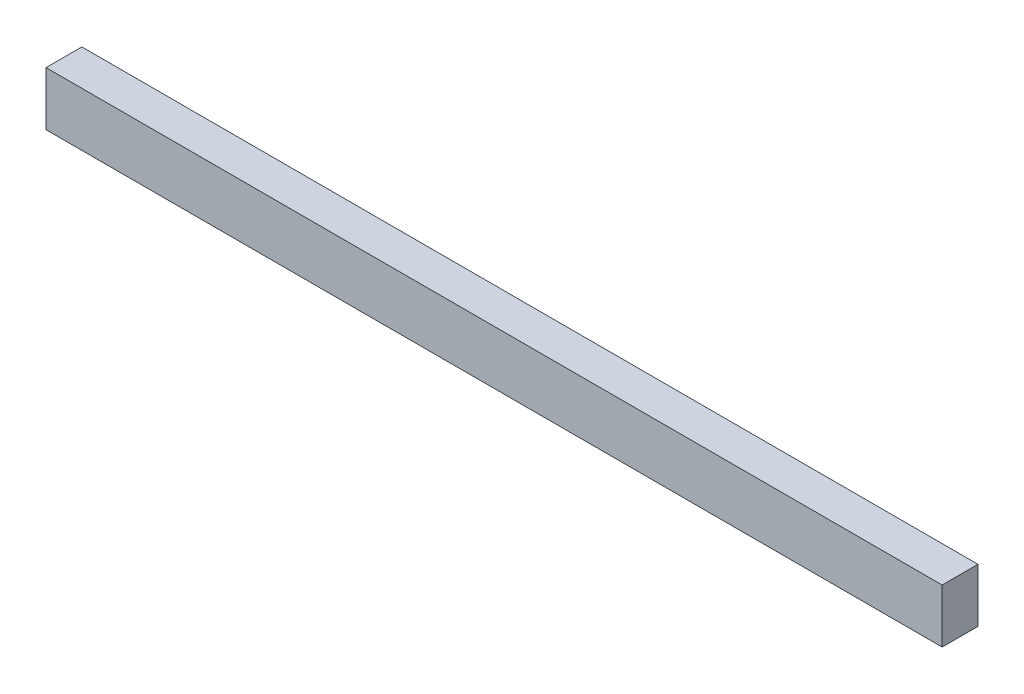
from build123d import *

# Parameters (mm, degrees)
CROQUIS2_W              = 1270
CROQUIS2_H              = 76.2
SALIENTE_EXTRUIR1_DEPTH = 50.8


with BuildPart() as part:
    # Croquis2 → Saliente-Extruir1 (new body)
    with BuildSketch(Plane.XY):
        Rectangle(CROQUIS2_W, CROQUIS2_H)
    extrude(amount=SALIENTE_EXTRUIR1_DEPTH)


solid = part.part
